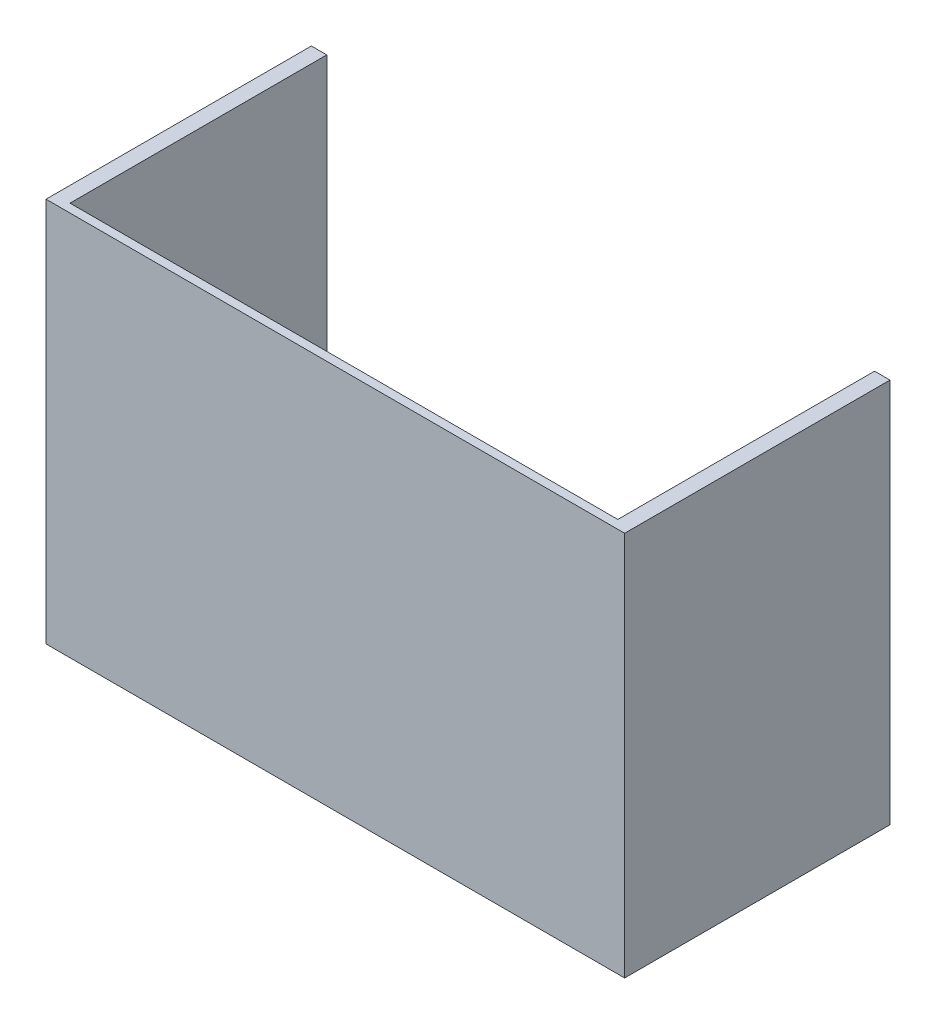
from build123d import *

# Parameters (mm, degrees)
BOSS_EXTRUDE1_DEPTH = 45


with BuildPart() as part:
    # Sketch1 → Boss-Extrude1 (new body)
    with BuildSketch(Plane.XZ.offset(-155)):
        Polygon((-195.2, 13), (-197, 13), (-197, 43), (-261, 43), (-261, 13), (-262.8, 13), (-262.8, 44), (-195.2, 44), align=None)
    extrude(amount=BOSS_EXTRUDE1_DEPTH)


solid = part.part
